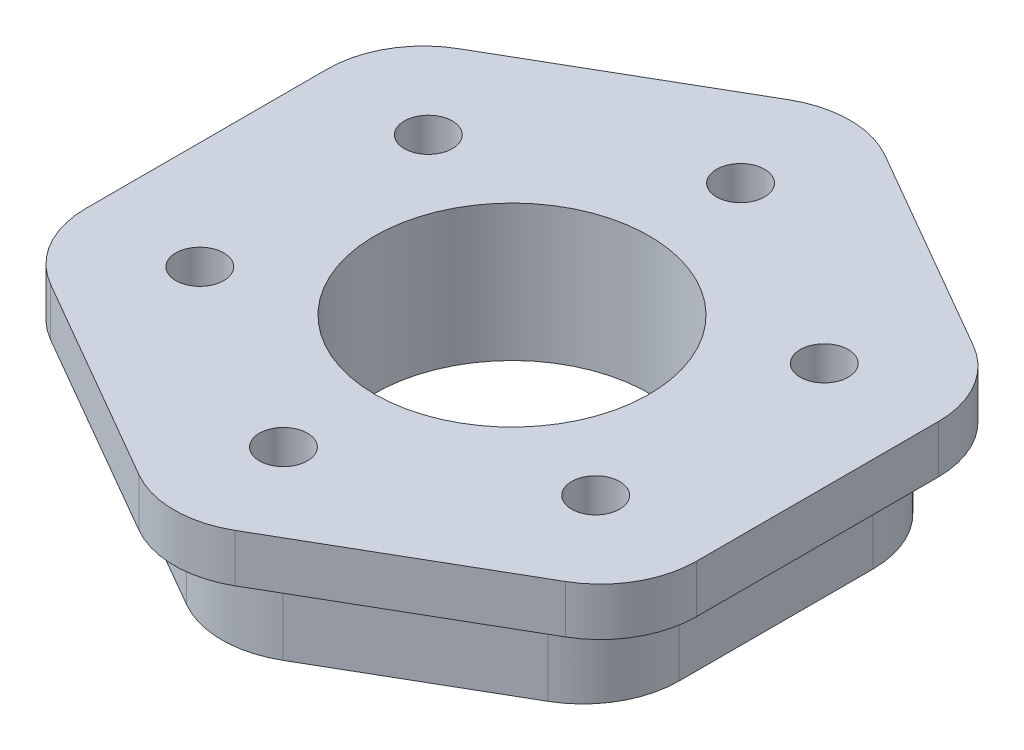
from build123d import *

# Parameters (mm, degrees)
BOSS_EXTRUDE1_DEPTH = 5
FILLET1_R           = 10
BOSS_EXTRUDE2_DEPTH = 9.2
CUT_EXTRUDE1_DEPTH  = 3.2
SKETCH2_R           = 2.4999999999999996
SKETCH2_R_2         = 2.500000000000053
SKETCH2_R_3         = 2.5000000000000964
SKETCH2_R_4         = 2.5000000000000018
SKETCH2_R_5         = 2.4999999999999947
SKETCH2_R_6         = 14.287500000000001
CUT_EXTRUDE2_DEPTH  = 50.49730061393943
FILLET2_R           = 10


with BuildPart() as part:
    # Sketch1 → Boss-Extrude1 (new body)
    with BuildSketch(Plane(origin=(0, 0, 0), x_dir=(1, 0, 0), z_dir=(0, 1, 0))):
        Polygon((31.8, 18.359738560230117), (-9.39e-15, 36.719477120460205), (-31.799999999999994, 18.359738560230117), (-31.799999999999986, -18.359738560230095), (2.025e-14, -36.719477120460205), (31.800000000000008, -18.35973856023011), align=None)
    extrude(amount=BOSS_EXTRUDE1_DEPTH)

    # Fillet1
    fillet1_edges = [part.edges().sort_by_distance(p)[0] for p in [
        (31.800000000000008, 2.5, 18.35973856023011),
        (2.025e-14, 2.5, 36.719477120460205),
        (-31.799999999999986, 2.5, 18.359738560230095),
        (-31.799999999999994, 2.5, -18.359738560230117),
        (-9.39e-15, 2.5, -36.719477120460205),
        (31.8, 2.5, -18.359738560230117),
    ]]
    fillet(fillet1_edges, radius=FILLET1_R)

    # Sketch3 → Boss-Extrude2 (add)
    with BuildSketch(Plane.XZ):
        Polygon((27.499999999999996, 15.877132402714718), (9.57e-15, 31.754264805429415), (-27.500000000000004, 15.877132402714711), (-27.499999999999996, -15.877132402714711), (1.826e-14, -31.754264805429422), (27.50000000000001, -15.877132402714718), align=None)
    extrude(amount=BOSS_EXTRUDE2_DEPTH)

    # Sketch4 → Cut-Extrude1 (cut)
    with BuildSketch(Plane.XZ):
        Polygon((2.8499999999999854, -30.108816538239008), (4.199999999999984, -32.44708512845699), (26.000000000000007, -19.86084926012314), (24.650000000000006, -17.522580669905157), align=None)
        Polygon((-25.999999999999996, -19.860849260123146), (-4.200000000000003, -32.447085128456976), (-2.8499999999999983, -30.108816538238976), (-24.649999999999988, -17.52258066990515), align=None)
        Polygon((27.499999999999996, -12.586235868333851), (30.200000000000003, -12.586235868333851), (30.200000000000006, 12.586235868333848), (27.499999999999996, 12.586235868333848), align=None)
        Polygon((24.650000000000006, 17.522580669905146), (26.00000000000001, 19.860849260123135), (4.200000000000031, 32.44708512845697), (2.8500000000000263, 30.108816538238973), align=None)
        Polygon((-30.19999999999999, 12.58623586833384), (-30.199999999999996, -12.586235868333855), (-27.5, -12.58623586833386), (-27.500000000000004, 12.58623586833384), align=None)
        Polygon((-4.199999999999982, 32.44708512845697), (-25.99999999999999, 19.860849260123125), (-24.64999999999999, 17.52258066990515), (-2.849999999999986, 30.108816538238987), align=None)
    extrude(amount=-CUT_EXTRUDE1_DEPTH, mode=Mode.SUBTRACT)

    # Sketch2 → Cut-Extrude2 (cut, through all)
    with BuildSketch(Plane(origin=(0, 5, 0), x_dir=(1, 0, 0), z_dir=(0, 1, 0))):
        with Locations(Location((1.561e-14, 23.799999999999994, 0), (0, 0, 270))):
            Circle(SKETCH2_R)
        with Locations(Location((20.61140461006965, 11.899999999999997, 0), (0, 0, 270))):
            Circle(SKETCH2_R_2)
        with Locations(Location((20.61140461006965, -11.899999999999993, 0), (0, 0, 270))):
            Circle(SKETCH2_R_3)
        with Locations(Location((-1.561e-14, -23.800000000000015, 0), (0, 0, 270))):
            Circle(SKETCH2_R_4)
        with Locations(Location((-20.61140461006965, -11.899999999999993, 0), (0, 0, 270))):
            Circle(SKETCH2_R_5)
        with Locations(Location((-20.611404610069634, 11.899999999999999, 0), (0, 0, 270))):
            Circle(SKETCH2_R_5)
        with Locations(Location((0, 0, 0), (0, 0, 270))):
            Circle(SKETCH2_R_6)
    extrude(amount=-CUT_EXTRUDE2_DEPTH, mode=Mode.SUBTRACT)

    # Fillet2
    fillet2_edges = [part.edges().sort_by_distance(p)[0] for p in [
        (27.499999999999996, -4.6, 15.877132402714718),
        (9.57e-15, -4.6, 31.754264805429415),
        (-27.500000000000004, -4.6, 15.877132402714711),
        (-27.499999999999996, -4.6, -15.877132402714711),
        (27.50000000000001, -4.6, -15.877132402714718),
        (1.826e-14, -4.6, -31.754264805429422),
    ]]
    fillet(fillet2_edges, radius=FILLET2_R)


solid = part.part
